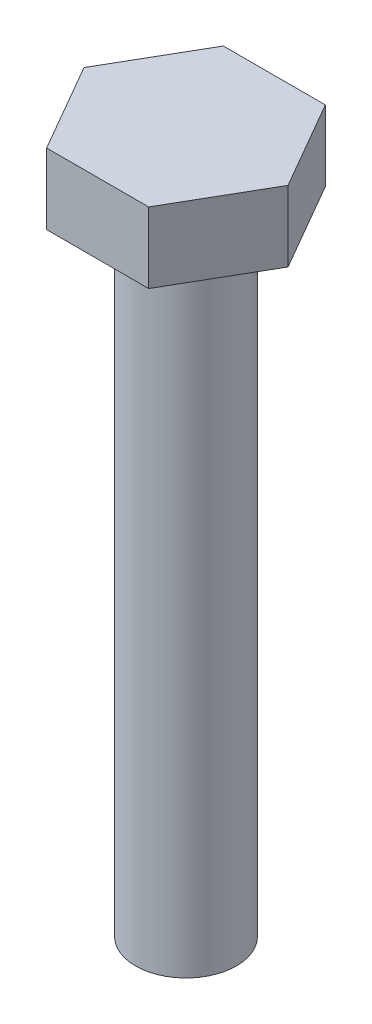
from build123d import *

# Parameters (mm, degrees)
SKETCH_1_R      = 2
EXTRUDE_1_DEPTH = 25
EXTRUDE_2_DEPTH = 2.8


with BuildPart() as part:
    # 草图1 → 凸台-拉伸1 (new body)
    with BuildSketch(Plane(origin=(0, 0, 0), x_dir=(1, 0, 0), z_dir=(0, 1, 0))):
        with Locations(Location((0, 0, 0), (0, 0, 270))):
            Circle(SKETCH_1_R)
    extrude(amount=EXTRUDE_1_DEPTH)

    # 草图2 → 凸台-拉伸2 (add)
    with BuildSketch(Plane(origin=(0, 25, 0), x_dir=(1, 0, 0), z_dir=(0, 1, 0))):
        Polygon((4.041451884, 0), (2.020725942, 3.5), (-2.020725942, 3.5), (-4.041451884, 0), (-2.020725942, -3.5), (2.020725942, -3.5), align=None)
    extrude(amount=EXTRUDE_2_DEPTH)


solid = part.part
